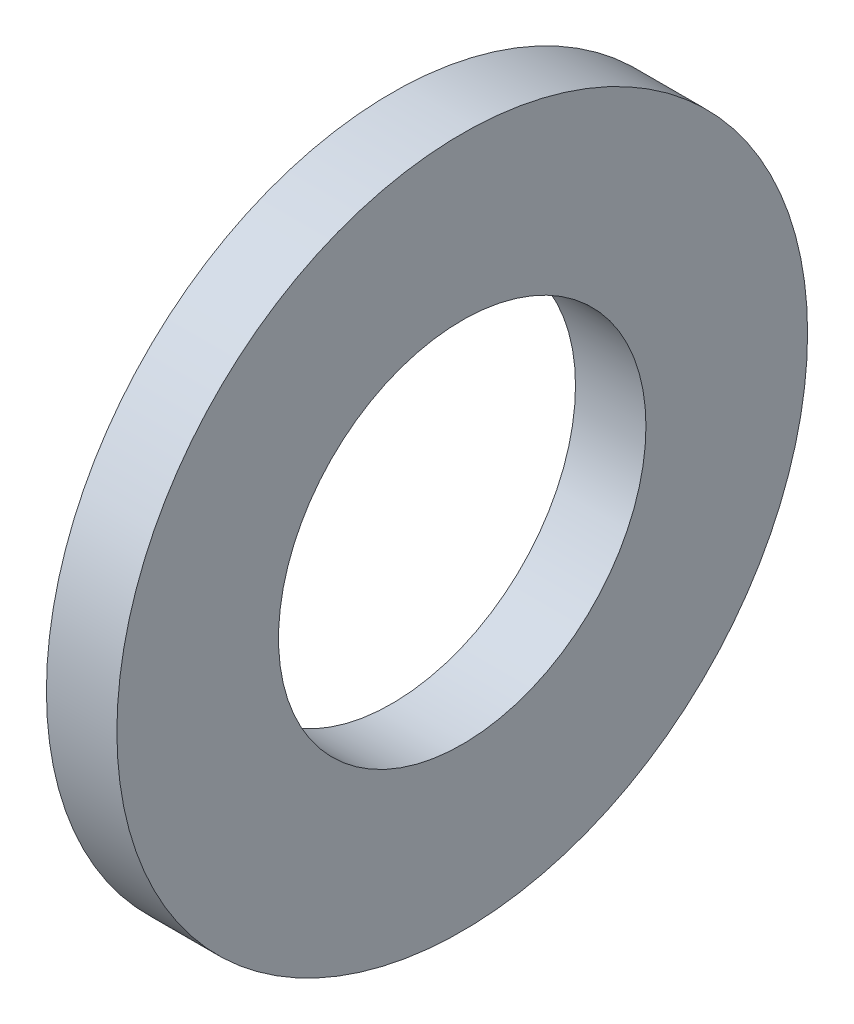
from build123d import *

# Parameters (mm, degrees)
SKETCH1_R           = 6.35
SKETCH1_R_2         = 3.3782
BOSS_EXTRUDE1_DEPTH = 1.2954


with BuildPart() as part:
    # Sketch1 → Boss-Extrude1 (new body)
    with BuildSketch(Plane(origin=(0, 0, 0), x_dir=(0, 0, -1), z_dir=(1, 0, 0))):
        Circle(SKETCH1_R)
        Circle(SKETCH1_R_2, mode=Mode.SUBTRACT)
    extrude(amount=BOSS_EXTRUDE1_DEPTH)


solid = part.part
